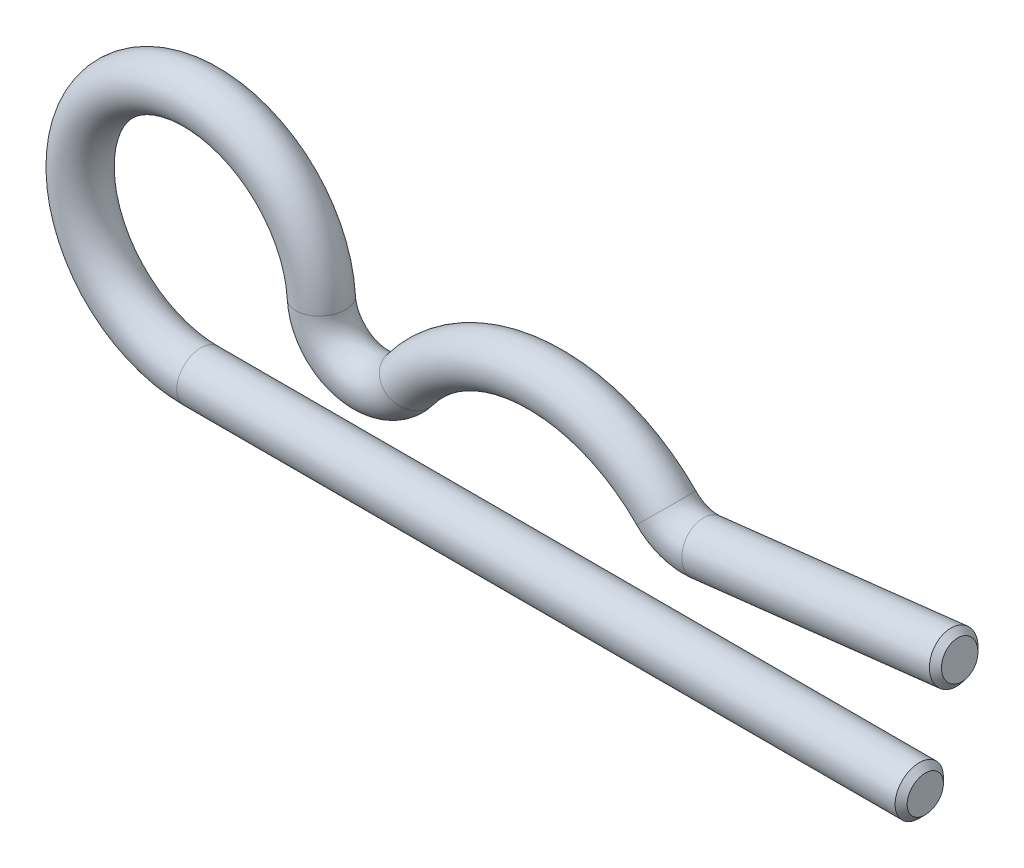
from build123d import *

# Parameters (mm, degrees)
SWEEP1_PROFILE_R = 1
CHAMFER1_SIZE    = 0.25


with BuildPart() as part:
    # Sweep1: sweep along a path in Sketch1
    with BuildLine(Plane.XY) as sweep1_path:
        Line((5, 0), (-25, 0))
        ThreePointArc((-25, 0), (-28.640054945, 8.4278273), (-20.009008115, 5.3))
        ThreePointArc((-20.009008115, 5.3), (-18.553993915, 3.462427202), (-16.327870059, 4.195988847))
        ThreePointArc((-16.327870059, 4.195988847), (-11.190495107, 6.984496232), (-5.728428937, 4.902615352))
        ThreePointArc((-5.728428937, 4.902615352), (-4.968402787, 4.418048803), (-4.072794538, 4.316410454))
        Line((-4.072794538, 4.316410454), (6.427235429, 5.521705225))
    # Sweep1 profile (on start of the path) → Sweep1 (sweep)
    with BuildSketch(Plane(origin=(5, 0, 0), x_dir=(0, -1, 0), z_dir=(-1, 0, 0))):
        Circle(SWEEP1_PROFILE_R)
    sweep(path=sweep1_path.line)

    # Chamfer1
    chamfer1_edges = [part.edges().sort_by_distance(p)[0] for p in [
        (6.5412762, 4.528229155, 0),
        (5, 1, 0),
    ]]
    chamfer(chamfer1_edges, length=CHAMFER1_SIZE)


solid = part.part
